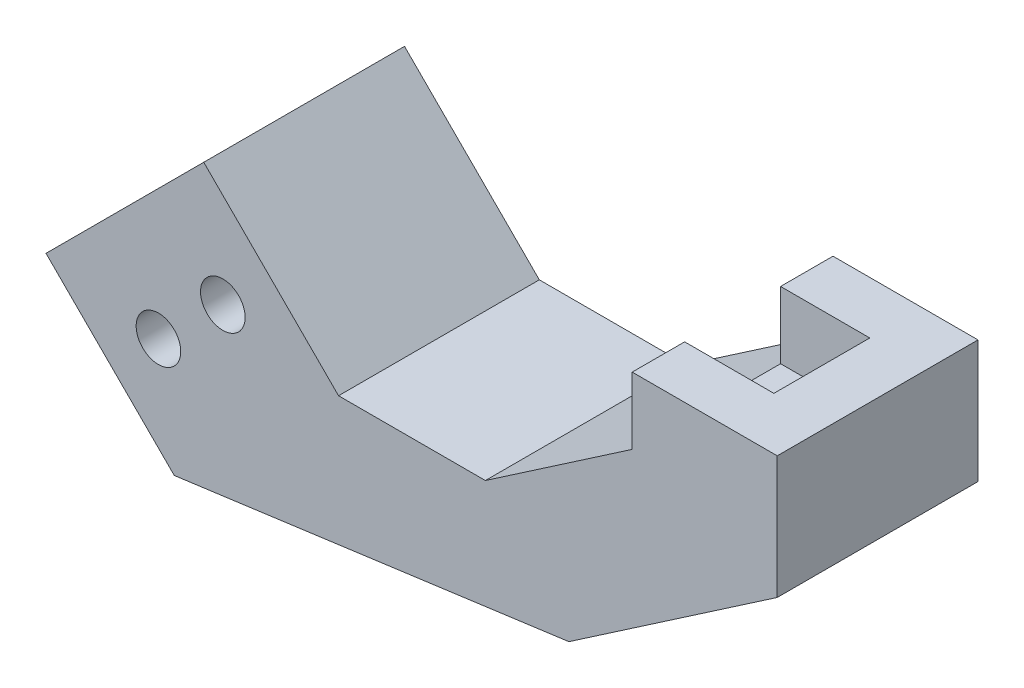
from build123d import *

# Parameters (mm, degrees)
BOSS_EXTRUDE1_DEPTH      = 5
BOSS_EXTRUDE1_DEPTH_BACK = 13
SKETCH2_R                = 1.5
CUT_EXTRUDE1_DEPTH       = 66.915554427
SKETCH3_R                = 2
CUT_EXTRUDE2_DEPTH       = 68.080998169
SKETCH4_W                = 8
SKETCH4_H                = 4.7
BOSS_EXTRUDE2_DEPTH      = 6


with BuildPart() as part:
    # Sketch1 → Boss-Extrude1 (new, two sides: drawn at the far end of the back side and taken through both)
    with BuildSketch(Plane.XY.offset(-BOSS_EXTRUDE1_DEPTH_BACK)):
        Polygon((0, 6), (5, 6), (5, -5), (-13.675831366, -17.768137002), (-49.056349186, -22.556349186), (-60.556349186, -11.056349186), (-46.414213562, 3.085786438), (-34.328427125, -9), (-21.164213562, -9), (-8, 0), (0, 0), align=None)
    extrude(amount=BOSS_EXTRUDE1_DEPTH + BOSS_EXTRUDE1_DEPTH_BACK)

    # Sketch2 → Cut-Extrude1 (cut, through all)
    with BuildSketch(Plane(origin=(0, 0, 0), x_dir=(1, 0, 0), z_dir=(0, 1, 0))):
        with Locations(Location((-3, 3.95, 0), (0, 0, 270))):
            Circle(SKETCH2_R)
    extrude(amount=-CUT_EXTRUDE1_DEPTH, mode=Mode.SUBTRACT)

    # Sketch3 → Cut-Extrude2 (cut, through all)
    with BuildSketch(Plane(origin=(0, 0, -13), x_dir=(-1, 0, 0), z_dir=(0, 0, -1))):
        with Locations((50.475737372, -12.65147749)):
            Circle(SKETCH3_R)
        with Locations((44.701932157, -7.111978477)):
            Circle(SKETCH3_R)
    extrude(amount=-CUT_EXTRUDE2_DEPTH, mode=Mode.SUBTRACT)

    # Sketch4 → Boss-Extrude2 (add)
    with BuildSketch(Plane(origin=(0, 0, 0), x_dir=(1, 0, 0), z_dir=(0, 1, 0))):
        with Locations((-4, -2.65)):
            Rectangle(SKETCH4_W, SKETCH4_H)
        with Locations((-4, 10.65)):
            Rectangle(SKETCH4_W, SKETCH4_H)
    extrude(amount=BOSS_EXTRUDE2_DEPTH)


solid = part.part
